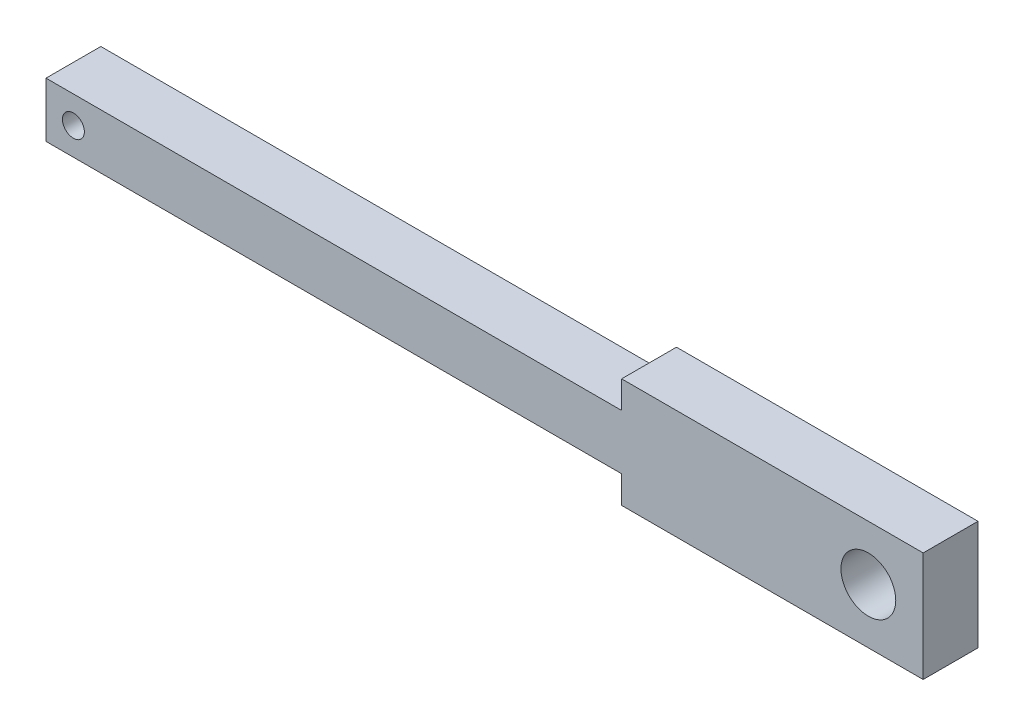
from build123d import *

# Parameters (mm, degrees)
SKETCH_1_R      = 5
SKETCH_1_R_2    = 2
EXTRUDE_1_DEPTH = 10


with BuildPart() as part:
    # 草图1 → 凸台-拉伸1 (new body)
    with BuildSketch(Plane.XY):
        Polygon((0, 0), (105, 0), (105, 5), (155, 5), (160, 5), (160, -15), (155, -15), (105, -15), (105, -10), (0, -10), align=None)
        with Locations((150, -5)):
            Circle(SKETCH_1_R, mode=Mode.SUBTRACT)
        with Locations((5, -5)):
            Circle(SKETCH_1_R_2, mode=Mode.SUBTRACT)
    extrude(amount=EXTRUDE_1_DEPTH)


solid = part.part
